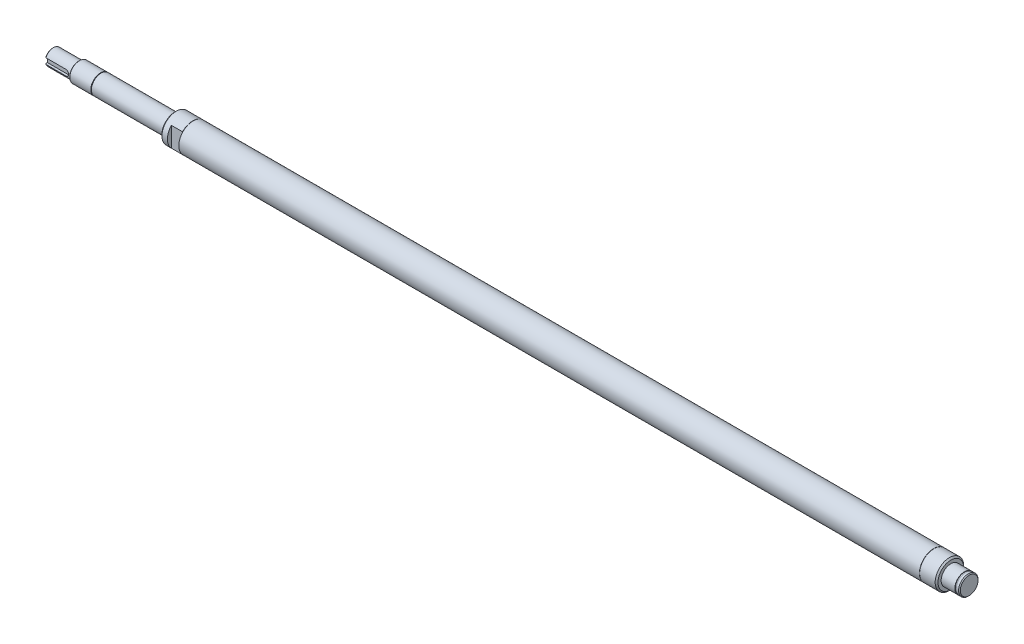
from build123d import *

# Parameters (mm, degrees)
EXTRUDE1_START = 84
SKETCH2_R      = 8.5
EXTRUDE1_DEPTH = 84
SKETCH3_R      = 7
EXTRUDE2_DEPTH = 23
EXTRUDE4_START = 6
EXTRUDE4_DEPTH = 10
EXTRUDE5_START = -6
EXTRUDE5_DEPTH = 10
CHAMFER1_SIZE  = 0.6135
CHAMFER2_SIZE  = 0.833333333
CHAMFER4_SIZE  = 0.75
CHAMFER5_SIZE  = 1.25
EXTRUDE6_DEPTH = 18.5
SKETCH7_R      = 2.5
EXTRUDE7_DEPTH = 7.62
SKETCH8_W      = 0.5
SKETCH8_H      = 0.7
CHAMFER6_SIZE  = 1.25


with BuildPart() as part:
    # Sketch1 → Revolve1 (revolve)
    with BuildSketch(Plane.XY, mode=Mode.PRIVATE) as revolve1_sk:
        Polygon((-6, 12.5), (-6, 0), (689, 0), (689, 8.5), (686.15, 8.5), (686.15, 8.15), (685, 8.15), (685, 8.5), (673, 8.5), (673, 12.5), (658.2, 12.5), (658.2, 12.25), (658, 12.25), (658, 12.5), (10, 12.5), (10, 12.25), (9.8, 12.25), (9.8, 12.5), align=None)
    revolve(revolve1_sk.sketch.rotate(Axis((-6, 0, 0), (1, 0, 0)), 270), axis=Axis((-6, 0, 0), (1, 0, 0)))

    # Sketch2 → Extrude1 (add)
    with BuildSketch(Plane.ZY.offset(6).offset(EXTRUDE1_START)):
        with Locations(Location((0, 0, 0), (0, 0, 180))):
            Circle(SKETCH2_R)
    extrude(amount=-EXTRUDE1_DEPTH)

    # Sketch3 → Extrude2 (add)
    with BuildSketch(Plane.ZY.offset(90)):
        Circle(SKETCH3_R)
    extrude(amount=EXTRUDE2_DEPTH)

    # Sketch5 → Extrude4 (cut)
    with BuildSketch(Plane(origin=(-6, 0, 0), x_dir=(0, 0, -1), z_dir=(1, 0, 0)).offset(EXTRUDE4_START)):
        with BuildLine():
            Line((9, 8.674675786), (9, -8.674675786))
            ThreePointArc((9, -8.674675786), (12.5, 0), (9, 8.674675786))
        make_face()
    extrude(amount=EXTRUDE4_DEPTH, mode=Mode.SUBTRACT)

    # Sketch6 → Extrude5 (cut)
    with BuildSketch(Plane(origin=(-6, 0, 0), x_dir=(0, -1, 0), z_dir=(-1, 0, 0)).offset(EXTRUDE5_START)):
        with BuildLine():
            Line((-8.674675786, 9), (8.674675786, 9))
            ThreePointArc((8.674675786, 9), (0, 12.5), (-8.674675786, 9))
        make_face()
    extrude(amount=-EXTRUDE5_DEPTH, mode=Mode.SUBTRACT)

    # Chamfer1
    chamfer1_edges = [part.edges().sort_by_distance(p)[0] for p in [
        (-90, 0, 8.5),
    ]]
    chamfer(chamfer1_edges, length=CHAMFER1_SIZE)

    # Chamfer2
    chamfer2_edges = [part.edges().sort_by_distance(p)[0] for p in [
        (-113, 0, -7),
    ]]
    chamfer(chamfer2_edges, length=CHAMFER2_SIZE)

    # Chamfer4
    chamfer4_edges = [part.edges().sort_by_distance(p)[0] for p in [
        (689, 0, 8.5),
    ]]
    chamfer(chamfer4_edges, length=CHAMFER4_SIZE)

    # Chamfer5
    chamfer5_edges = [part.edges().sort_by_distance(p)[0] for p in [
        (673, 0, 12.5),
    ]]
    chamfer(chamfer5_edges, length=CHAMFER5_SIZE)

    # Sketch4 → Extrude6 (cut)
    with BuildSketch(Plane.ZY.offset(113)):
        with BuildLine():
            Line((7.071067812, 2.5), (4.5, 2.5))
            Line((4.5, 2.5), (4.5, -2.5))
            Line((4.5, -2.5), (7.071067812, -2.5))
            ThreePointArc((7.071067812, -2.5), (7.5, 0), (7.071067812, 2.5))
        make_face()
    extrude(amount=-EXTRUDE6_DEPTH, mode=Mode.SUBTRACT)

    # Sketch7 → Extrude7 (cut)
    with BuildSketch(Plane.XY.offset(4.5)):
        with Locations((-94.5, 0)):
            Circle(SKETCH7_R)
    extrude(amount=EXTRUDE7_DEPTH, mode=Mode.SUBTRACT)

    # Sketch8 → Cut-Revolve1 (revolve, cut)
    with BuildSketch(Plane(origin=(0, 0, 0), x_dir=(1, 0, 0), z_dir=(0, 1, 0))):
        with Locations((-70.75, 8.15)):
            Rectangle(SKETCH8_W, SKETCH8_H)
    revolve(axis=Axis((0, 0, 0), (-1, 0, 0)), mode=Mode.SUBTRACT)

    # Chamfer6
    chamfer6_edges = [part.edges().sort_by_distance(p)[0] for p in [
        (-6, 0, 12.5),
    ]]
    chamfer(chamfer6_edges, length=CHAMFER6_SIZE)


solid = part.part
